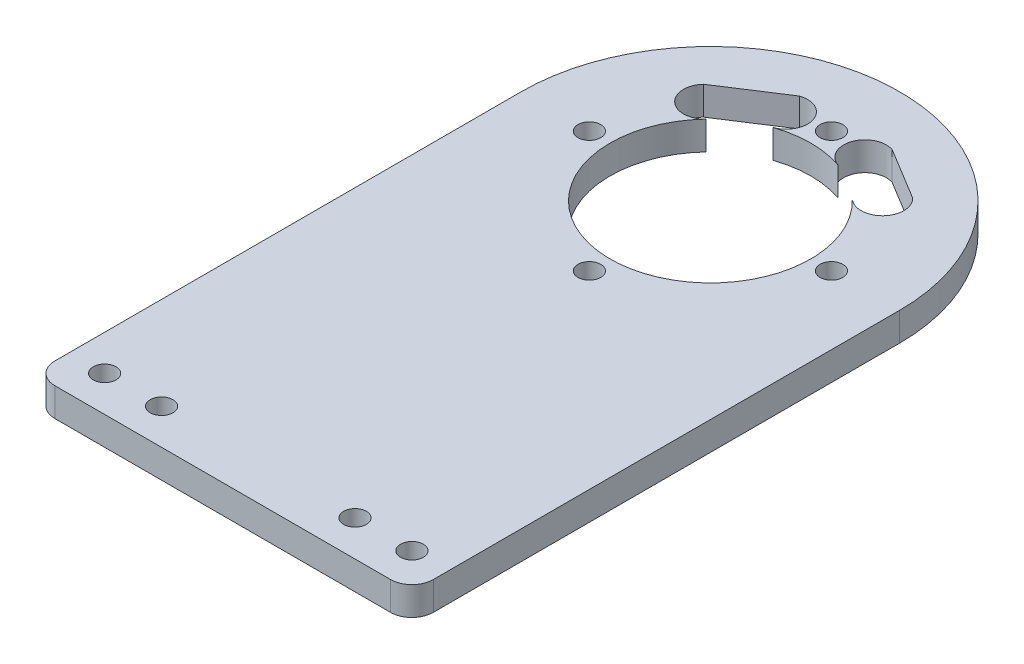
from build123d import *

# Parameters (mm, degrees)
SKETCH_1_R          = 1.6
EXTRUDE_1_DEPTH     = 4
SKETCH_2_R          = 1.6
CUT_EXTRUDE_1_DEPTH = 10
FILLET_1_R          = 3


with BuildPart() as part:
    # 草图1 → 凸台-拉伸1 (new body)
    with BuildSketch(Plane(origin=(0, 0, 0), x_dir=(1, 0, 0), z_dir=(0, 1, 0))):
        with BuildLine():
            Line((-26.580295873, 0), (-26.580295873, -68.504426064))
            Line((-26.580295873, -68.504426064), (26.580295873, -68.504426064))
            Line((26.580295873, -68.504426064), (26.580295873, 0))
            ThreePointArc((26.580295873, 0), (0, 26.580295873), (-26.580295873, 0))
        make_face()
        with Locations(Location((17, 0, 0), (0, 0, 270))):
            Circle(SKETCH_1_R, mode=Mode.SUBTRACT)
        with Locations(Location((-17, 0, 0), (0, 0, 90))):
            Circle(SKETCH_1_R, mode=Mode.SUBTRACT)
        with Locations(Location((0, 17, 0), (0, 0, 270))):
            Circle(SKETCH_1_R, mode=Mode.SUBTRACT)
        with Locations(Location((0, -17, 0), (0, 0, 270))):
            Circle(SKETCH_1_R, mode=Mode.SUBTRACT)
        with BuildLine():
            Line((-14.695026261, 13.713220631), (-6.515150502, 19.014728906))
            ThreePointArc((-6.515150502, 19.014728906), (-2.694610628, 17.158059668), (-4.560612538, 13.342069303))
            ThreePointArc((-4.560612538, 13.342069303), (0, 14.1), (4.560612538, 13.342069303))
            ThreePointArc((4.560612538, 13.342069303), (2.694610628, 17.158059668), (6.515150502, 19.014728906))
            Line((6.515150502, 19.014728906), (13.857784146, 14.558867106))
            ThreePointArc((13.857784146, 14.558867106), (13.927445578, 10.331314347), (9.700465883, 10.232837419))
            ThreePointArc((9.700465883, 10.232837419), (0.41557213, -14.093874549), (-10.286539783, 9.643500365))
            ThreePointArc((-10.286539783, 9.643500365), (-14.510070274, 9.490986437), (-14.695026261, 13.713220631))
        make_face(mode=Mode.SUBTRACT)
    extrude(amount=EXTRUDE_1_DEPTH)

    # 草图2 → 切除-拉伸1 (cut)
    with BuildSketch(Plane.XZ):
        with Locations(Location((21.580295873, 63.504426064, 0), (0, 0, 270))):
            Circle(SKETCH_2_R)
        with Locations(Location((13.580295873, 63.504426064, 0), (0, 0, 270))):
            Circle(SKETCH_2_R)
        with Locations(Location((-13.580295873, 63.504426064, 0), (0, 0, 270))):
            Circle(SKETCH_2_R)
        with Locations(Location((-21.580295873, 63.504426064, 0), (0, 0, 270))):
            Circle(SKETCH_2_R)
    extrude(amount=-CUT_EXTRUDE_1_DEPTH, mode=Mode.SUBTRACT)

    # 圆角1
    fillet_1_edges = [part.edges().sort_by_distance(p)[0] for p in [
        (-26.580295873, 2, 68.504426064),
        (26.580295873, 2, 68.504426064),
    ]]
    fillet(fillet_1_edges, radius=FILLET_1_R)


solid = part.part
